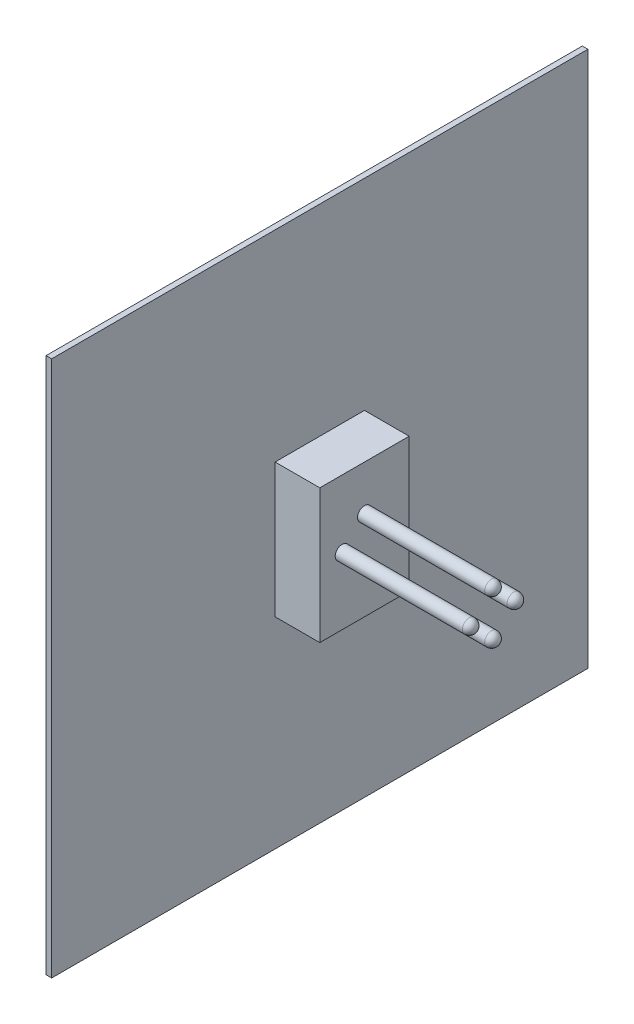
from build123d import *

# Parameters (mm, degrees)
SKETCH1_W           = 304.8
SKETCH1_H           = 304.8
BOSS_EXTRUDE1_DEPTH = 3.175
SKETCH2_W           = 50.8
SKETCH2_H           = 76.2
BOSS_EXTRUDE2_DEPTH = 25.4
SKETCH3_R           = 3.937
BOSS_EXTRUDE3_DEPTH = 76.2
FILLET2_R           = 3.937


with BuildPart() as part:
    # Sketch1 → Boss-Extrude1 (new body)
    with BuildSketch(Plane(origin=(0, 0, 0), x_dir=(0, 0, -1), z_dir=(1, 0, 0))):
        with Locations((152.4, 152.4)):
            Rectangle(SKETCH1_W, SKETCH1_H)
    extrude(amount=BOSS_EXTRUDE1_DEPTH)

    # Sketch2 → Boss-Extrude2 (add)
    with BuildSketch(Plane(origin=(3.175, 0, 0), x_dir=(0, 0, -1), z_dir=(1, 0, 0))):
        with Locations((152.4, 152.4)):
            Rectangle(SKETCH2_W, SKETCH2_H)
    extrude(amount=BOSS_EXTRUDE2_DEPTH)

    # Sketch3 → Boss-Extrude3 (add)
    with BuildSketch(Plane(origin=(28.575, 0, 0), x_dir=(0, 0, -1), z_dir=(1, 0, 0))):
        with Locations(Location((152.4, 139.7, 0), (0, 0, 180))):
            Circle(SKETCH3_R)
        with Locations(Location((165.1, 152.4, 0), (0, 0, 180))):
            Circle(SKETCH3_R)
        with Locations(Location((152.4, 165.1, 0), (0, 0, 180))):
            Circle(SKETCH3_R)
        with Locations(Location((139.7, 152.4, 0), (0, 0, 180))):
            Circle(SKETCH3_R)
    extrude(amount=BOSS_EXTRUDE3_DEPTH)

    # Fillet2
    fillet2_edges = [part.edges().sort_by_distance(p)[0] for p in [
        (104.775, 139.7, -156.337),
        (104.775, 152.4, -169.037),
        (104.775, 165.1, -156.337),
        (104.775, 152.4, -143.637),
    ]]
    fillet(fillet2_edges, radius=FILLET2_R)


solid = part.part
